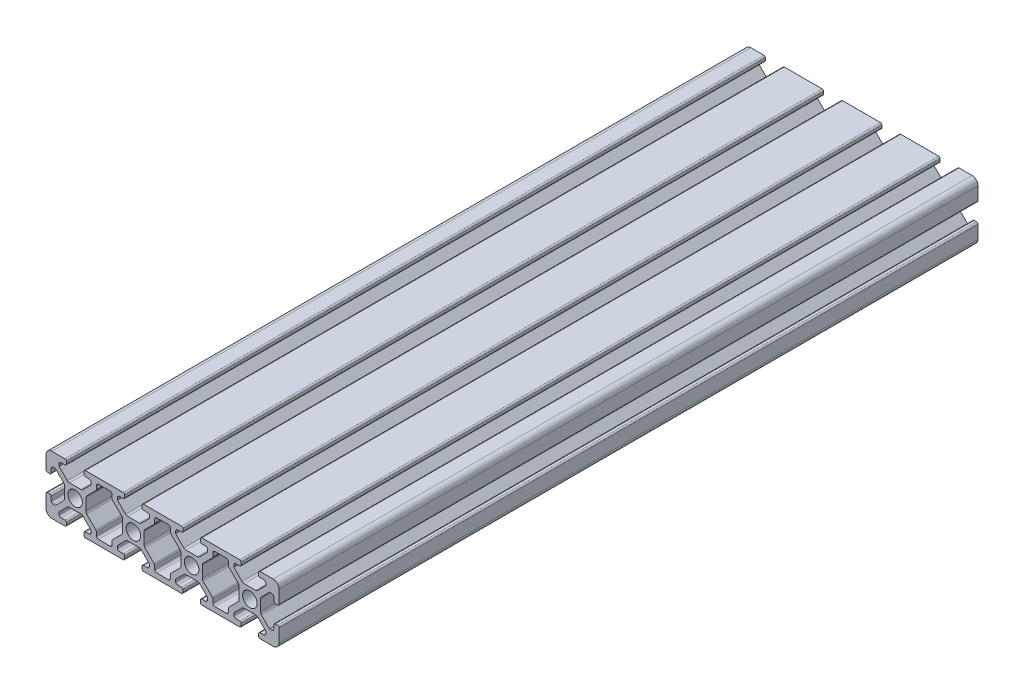
from build123d import *

# Parameters (mm, degrees)
SKETCH1_R           = 2.5
BOSS_EXTRUDE1_DEPTH = 240


with BuildPart() as part:
    # Sketch1 → Boss-Extrude1 (new body)
    with BuildSketch(Plane.XY):
        with BuildLine():
            Line((2, 0), (6.5, 0))
            ThreePointArc((6.5, 0), (6.853553391, 0.146446609), (7, 0.5))
            Line((7, 0.5), (7, 1.3))
            ThreePointArc((7, 1.3), (6.853553391, 1.653553391), (6.5, 1.8))
            Line((6.5, 1.8), (5.25, 1.8))
            ThreePointArc((5.25, 1.8), (4.719669914, 2.019669914), (4.5, 2.55))
            Line((4.5, 2.55), (4.5, 3.227207794))
            Line((4.5, 3.227207794), (7.329898987, 6.057106781))
            ThreePointArc((7.329898987, 6.057106781), (7.654322336, 6.273879533), (8.037005769, 6.35))
            Line((8.037005769, 6.35), (11.962994231, 6.35))
            ThreePointArc((11.962994231, 6.35), (12.345677664, 6.273879533), (12.670101013, 6.057106781))
            Line((12.670101013, 6.057106781), (15.5, 3.227207794))
            Line((15.5, 3.227207794), (15.5, 2.55))
            ThreePointArc((15.5, 2.55), (15.280330086, 2.019669914), (14.75, 1.8))
            Line((14.75, 1.8), (13.5, 1.8))
            ThreePointArc((13.5, 1.8), (13.146446609, 1.653553391), (13, 1.3))
            Line((13, 1.3), (13, 0.5))
            ThreePointArc((13, 0.5), (13.146446609, 0.146446609), (13.5, 0))
            Line((13.5, 0), (26.5, 0))
            ThreePointArc((26.5, 0), (26.853553391, 0.146446609), (27, 0.5))
            Line((27, 0.5), (27, 1.3))
            ThreePointArc((27, 1.3), (26.853553391, 1.653553391), (26.5, 1.8))
            Line((26.5, 1.8), (25.25, 1.8))
            ThreePointArc((25.25, 1.8), (24.719669914, 2.019669914), (24.5, 2.55))
            Line((24.5, 2.55), (24.5, 3.227207794))
            Line((24.5, 3.227207794), (27.329898987, 6.057106781))
            ThreePointArc((27.329898987, 6.057106781), (27.654322336, 6.273879533), (28.037005769, 6.35))
            Line((28.037005769, 6.35), (31.962994231, 6.35))
            ThreePointArc((31.962994231, 6.35), (32.345677664, 6.273879533), (32.670101013, 6.057106781))
            Line((32.670101013, 6.057106781), (35.5, 3.227207794))
            Line((35.5, 3.227207794), (35.5, 2.55))
            ThreePointArc((35.5, 2.55), (35.280330086, 2.019669914), (34.75, 1.8))
            Line((34.75, 1.8), (33.5, 1.8))
            ThreePointArc((33.5, 1.8), (33.146446609, 1.653553391), (33, 1.3))
            Line((33, 1.3), (33, 0.5))
            ThreePointArc((33, 0.5), (33.146446609, 0.146446609), (33.5, 0))
            Line((33.5, 0), (46.5, 0))
            ThreePointArc((46.5, 0), (46.853553391, 0.146446609), (47, 0.5))
            Line((47, 0.5), (47, 1.3))
            ThreePointArc((47, 1.3), (46.853553391, 1.653553391), (46.5, 1.8))
            Line((46.5, 1.8), (45.25, 1.8))
            ThreePointArc((45.25, 1.8), (44.719669914, 2.019669914), (44.5, 2.55))
            Line((44.5, 2.55), (44.5, 3.227207794))
            Line((44.5, 3.227207794), (47.329898987, 6.057106781))
            ThreePointArc((47.329898987, 6.057106781), (47.654322336, 6.273879533), (48.037005769, 6.35))
            Line((48.037005769, 6.35), (51.962994231, 6.35))
            ThreePointArc((51.962994231, 6.35), (52.345677664, 6.273879533), (52.670101013, 6.057106781))
            Line((52.670101013, 6.057106781), (55.5, 3.227207794))
            Line((55.5, 3.227207794), (55.5, 2.55))
            ThreePointArc((55.5, 2.55), (55.280330086, 2.019669914), (54.75, 1.8))
            Line((54.75, 1.8), (53.5, 1.8))
            ThreePointArc((53.5, 1.8), (53.146446609, 1.653553391), (53, 1.3))
            Line((53, 1.3), (53, 0.5))
            ThreePointArc((53, 0.5), (53.146446609, 0.146446609), (53.5, 0))
            Line((53.5, 0), (66.5, 0))
            ThreePointArc((66.5, 0), (66.853553391, 0.146446609), (67, 0.5))
            Line((67, 0.5), (67, 1.3))
            ThreePointArc((67, 1.3), (66.853553391, 1.653553391), (66.5, 1.8))
            Line((66.5, 1.8), (65.25, 1.8))
            ThreePointArc((65.25, 1.8), (64.719669914, 2.019669914), (64.5, 2.55))
            Line((64.5, 2.55), (64.5, 3.227207794))
            Line((64.5, 3.227207794), (67.329898987, 6.057106781))
            ThreePointArc((67.329898987, 6.057106781), (67.654322336, 6.273879533), (68.037005769, 6.35))
            Line((68.037005769, 6.35), (71.962994231, 6.35))
            ThreePointArc((71.962994231, 6.35), (72.345677664, 6.273879533), (72.670101013, 6.057106781))
            Line((72.670101013, 6.057106781), (75.5, 3.227207794))
            Line((75.5, 3.227207794), (75.5, 2.55))
            ThreePointArc((75.5, 2.55), (75.280330086, 2.019669914), (74.75, 1.8))
            Line((74.75, 1.8), (73.5, 1.8))
            ThreePointArc((73.5, 1.8), (73.146446609, 1.653553391), (73, 1.3))
            Line((73, 1.3), (73, 0.5))
            ThreePointArc((73, 0.5), (73.146446609, 0.146446609), (73.5, 0))
            Line((73.5, 0), (78, 0))
            ThreePointArc((78, 0), (79.414213562, 0.585786438), (80, 2))
            Line((80, 2), (80, 6.5))
            ThreePointArc((80, 6.5), (79.853553391, 6.853553391), (79.5, 7))
            Line((79.5, 7), (78.7, 7))
            ThreePointArc((78.7, 7), (78.346446609, 6.853553391), (78.2, 6.5))
            Line((78.2, 6.5), (78.2, 5.25))
            ThreePointArc((78.2, 5.25), (77.980330086, 4.719669914), (77.45, 4.5))
            Line((77.45, 4.5), (76.772792206, 4.5))
            Line((76.772792206, 4.5), (73.942893219, 7.329898987))
            ThreePointArc((73.942893219, 7.329898987), (73.726120467, 7.654322336), (73.65, 8.037005769))
            Line((73.65, 8.037005769), (73.65, 11.962994231))
            ThreePointArc((73.65, 11.962994231), (73.726120467, 12.345677664), (73.942893219, 12.670101013))
            Line((73.942893219, 12.670101013), (76.772792206, 15.5))
            Line((76.772792206, 15.5), (77.45, 15.5))
            ThreePointArc((77.45, 15.5), (77.980330086, 15.280330086), (78.2, 14.75))
            Line((78.2, 14.75), (78.2, 13.5))
            ThreePointArc((78.2, 13.5), (78.346446609, 13.146446609), (78.7, 13))
            Line((78.7, 13), (79.5, 13))
            ThreePointArc((79.5, 13), (79.853553391, 13.146446609), (80, 13.5))
            Line((80, 13.5), (80, 18))
            ThreePointArc((80, 18), (79.414213562, 19.414213562), (78, 20))
            Line((78, 20), (73.5, 20))
            ThreePointArc((73.5, 20), (73.146446609, 19.853553391), (73, 19.5))
            Line((73, 19.5), (73, 18.7))
            ThreePointArc((73, 18.7), (73.146446609, 18.346446609), (73.5, 18.2))
            Line((73.5, 18.2), (74.75, 18.2))
            ThreePointArc((74.75, 18.2), (75.280330086, 17.980330086), (75.5, 17.45))
            Line((75.5, 17.45), (75.5, 16.772792206))
            Line((75.5, 16.772792206), (72.670101013, 13.942893219))
            ThreePointArc((72.670101013, 13.942893219), (72.345677664, 13.726120467), (71.962994231, 13.65))
            Line((71.962994231, 13.65), (68.037005769, 13.65))
            ThreePointArc((68.037005769, 13.65), (67.654322336, 13.726120467), (67.329898987, 13.942893219))
            Line((67.329898987, 13.942893219), (64.5, 16.772792206))
            Line((64.5, 16.772792206), (64.5, 17.45))
            ThreePointArc((64.5, 17.45), (64.719669914, 17.980330086), (65.25, 18.2))
            Line((65.25, 18.2), (66.5, 18.2))
            ThreePointArc((66.5, 18.2), (66.853553391, 18.346446609), (67, 18.7))
            Line((67, 18.7), (67, 19.5))
            ThreePointArc((67, 19.5), (66.853553391, 19.853553391), (66.5, 20))
            Line((66.5, 20), (53.5, 20))
            ThreePointArc((53.5, 20), (53.146446609, 19.853553391), (53, 19.5))
            Line((53, 19.5), (53, 18.7))
            ThreePointArc((53, 18.7), (53.146446609, 18.346446609), (53.5, 18.2))
            Line((53.5, 18.2), (54.75, 18.2))
            ThreePointArc((54.75, 18.2), (55.280330086, 17.980330086), (55.5, 17.45))
            Line((55.5, 17.45), (55.5, 16.772792206))
            Line((55.5, 16.772792206), (52.670101013, 13.942893219))
            ThreePointArc((52.670101013, 13.942893219), (52.345677664, 13.726120467), (51.962994231, 13.65))
            Line((51.962994231, 13.65), (48.037005769, 13.65))
            ThreePointArc((48.037005769, 13.65), (47.654322336, 13.726120467), (47.329898987, 13.942893219))
            Line((47.329898987, 13.942893219), (44.5, 16.772792206))
            Line((44.5, 16.772792206), (44.5, 17.45))
            ThreePointArc((44.5, 17.45), (44.719669914, 17.980330086), (45.25, 18.2))
            Line((45.25, 18.2), (46.5, 18.2))
            ThreePointArc((46.5, 18.2), (46.853553391, 18.346446609), (47, 18.7))
            Line((47, 18.7), (47, 19.5))
            ThreePointArc((47, 19.5), (46.853553391, 19.853553391), (46.5, 20))
            Line((46.5, 20), (33.5, 20))
            ThreePointArc((33.5, 20), (33.146446609, 19.853553391), (33, 19.5))
            Line((33, 19.5), (33, 18.7))
            ThreePointArc((33, 18.7), (33.146446609, 18.346446609), (33.5, 18.2))
            Line((33.5, 18.2), (34.75, 18.2))
            ThreePointArc((34.75, 18.2), (35.280330086, 17.980330086), (35.5, 17.45))
            Line((35.5, 17.45), (35.5, 16.772792206))
            Line((35.5, 16.772792206), (32.670101013, 13.942893219))
            ThreePointArc((32.670101013, 13.942893219), (32.345677664, 13.726120467), (31.962994231, 13.65))
            Line((31.962994231, 13.65), (28.037005769, 13.65))
            ThreePointArc((28.037005769, 13.65), (27.654322336, 13.726120467), (27.329898987, 13.942893219))
            Line((27.329898987, 13.942893219), (24.5, 16.772792206))
            Line((24.5, 16.772792206), (24.5, 17.45))
            ThreePointArc((24.5, 17.45), (24.719669914, 17.980330086), (25.25, 18.2))
            Line((25.25, 18.2), (26.5, 18.2))
            ThreePointArc((26.5, 18.2), (26.853553391, 18.346446609), (27, 18.7))
            Line((27, 18.7), (27, 19.5))
            ThreePointArc((27, 19.5), (26.853553391, 19.853553391), (26.5, 20))
            Line((26.5, 20), (13.5, 20))
            ThreePointArc((13.5, 20), (13.146446609, 19.853553391), (13, 19.5))
            Line((13, 19.5), (13, 18.7))
            ThreePointArc((13, 18.7), (13.146446609, 18.346446609), (13.5, 18.2))
            Line((13.5, 18.2), (14.75, 18.2))
            ThreePointArc((14.75, 18.2), (15.280330086, 17.980330086), (15.5, 17.45))
            Line((15.5, 17.45), (15.5, 16.772792206))
            Line((15.5, 16.772792206), (12.670101013, 13.942893219))
            ThreePointArc((12.670101013, 13.942893219), (12.345677664, 13.726120467), (11.962994231, 13.65))
            Line((11.962994231, 13.65), (8.037005769, 13.65))
            ThreePointArc((8.037005769, 13.65), (7.654322336, 13.726120467), (7.329898987, 13.942893219))
            Line((7.329898987, 13.942893219), (4.5, 16.772792206))
            Line((4.5, 16.772792206), (4.5, 17.45))
            ThreePointArc((4.5, 17.45), (4.719669914, 17.980330086), (5.25, 18.2))
            Line((5.25, 18.2), (6.5, 18.2))
            ThreePointArc((6.5, 18.2), (6.853553391, 18.346446609), (7, 18.7))
            Line((7, 18.7), (7, 19.5))
            ThreePointArc((7, 19.5), (6.853553391, 19.853553391), (6.5, 20))
            Line((6.5, 20), (2, 20))
            ThreePointArc((2, 20), (0.585786438, 19.414213562), (0, 18))
            Line((0, 18), (0, 13.5))
            ThreePointArc((0, 13.5), (0.146446609, 13.146446609), (0.5, 13))
            Line((0.5, 13), (1.3, 13))
            ThreePointArc((1.3, 13), (1.653553391, 13.146446609), (1.8, 13.5))
            Line((1.8, 13.5), (1.8, 14.75))
            ThreePointArc((1.8, 14.75), (2.019669914, 15.280330086), (2.55, 15.5))
            Line((2.55, 15.5), (3.227207794, 15.5))
            Line((3.227207794, 15.5), (6.057106781, 12.670101013))
            ThreePointArc((6.057106781, 12.670101013), (6.273879533, 12.345677664), (6.35, 11.962994231))
            Line((6.35, 11.962994231), (6.35, 8.037005769))
            ThreePointArc((6.35, 8.037005769), (6.273879533, 7.654322336), (6.057106781, 7.329898987))
            Line((6.057106781, 7.329898987), (3.227207794, 4.5))
            Line((3.227207794, 4.5), (2.55, 4.5))
            ThreePointArc((2.55, 4.5), (2.019669914, 4.719669914), (1.8, 5.25))
            Line((1.8, 5.25), (1.8, 6.5))
            ThreePointArc((1.8, 6.5), (1.653553391, 6.853553391), (1.3, 7))
            Line((1.3, 7), (0.5, 7))
            ThreePointArc((0.5, 7), (0.146446609, 6.853553391), (0, 6.5))
            Line((0, 6.5), (0, 2))
            ThreePointArc((0, 2), (0.585786438, 0.585786438), (2, 0))
        make_face()
        with Locations((10, 10)):
            Circle(SKETCH1_R, mode=Mode.SUBTRACT)
        with Locations((30, 10)):
            Circle(SKETCH1_R, mode=Mode.SUBTRACT)
        with Locations((50, 10)):
            Circle(SKETCH1_R, mode=Mode.SUBTRACT)
        with Locations((70, 10)):
            Circle(SKETCH1_R, mode=Mode.SUBTRACT)
        with BuildLine():
            Line((33.942893219, 12.670101013), (37.080330086, 15.80753788))
            ThreePointArc((37.080330086, 15.80753788), (37.242909649, 16.050855391), (37.3, 16.337867966))
            Line((37.3, 16.337867966), (37.3, 17.45))
            ThreePointArc((37.3, 17.45), (37.519669914, 17.980330086), (38.05, 18.2))
            Line((38.05, 18.2), (41.95, 18.2))
            ThreePointArc((41.95, 18.2), (42.480330086, 17.980330086), (42.7, 17.45))
            Line((42.7, 17.45), (42.7, 16.337867966))
            ThreePointArc((42.7, 16.337867966), (42.757090351, 16.050855391), (42.919669914, 15.80753788))
            Line((42.919669914, 15.80753788), (46.057106781, 12.670101013))
            ThreePointArc((46.057106781, 12.670101013), (46.273879533, 12.345677664), (46.35, 11.962994231))
            Line((46.35, 11.962994231), (46.35, 8.037005769))
            ThreePointArc((46.35, 8.037005769), (46.273879533, 7.654322336), (46.057106781, 7.329898987))
            Line((46.057106781, 7.329898987), (42.919669914, 4.19246212))
            ThreePointArc((42.919669914, 4.19246212), (42.757090351, 3.949144609), (42.7, 3.662132034))
            Line((42.7, 3.662132034), (42.7, 2.55))
            ThreePointArc((42.7, 2.55), (42.480330086, 2.019669914), (41.95, 1.8))
            Line((41.95, 1.8), (38.05, 1.8))
            ThreePointArc((38.05, 1.8), (37.519669914, 2.019669914), (37.3, 2.55))
            Line((37.3, 2.55), (37.3, 3.662132034))
            ThreePointArc((37.3, 3.662132034), (37.242909649, 3.949144609), (37.080330086, 4.19246212))
            Line((37.080330086, 4.19246212), (33.942893219, 7.329898987))
            ThreePointArc((33.942893219, 7.329898987), (33.726120467, 7.654322336), (33.65, 8.037005769))
            Line((33.65, 8.037005769), (33.65, 11.962994231))
            ThreePointArc((33.65, 11.962994231), (33.726120467, 12.345677664), (33.942893219, 12.670101013))
        make_face(mode=Mode.SUBTRACT)
        with BuildLine():
            Line((22.919669914, 15.80753788), (26.057106781, 12.670101013))
            ThreePointArc((26.057106781, 12.670101013), (26.273879533, 12.345677664), (26.35, 11.962994231))
            Line((26.35, 11.962994231), (26.35, 8.037005769))
            ThreePointArc((26.35, 8.037005769), (26.273879533, 7.654322336), (26.057106781, 7.329898987))
            Line((26.057106781, 7.329898987), (22.919669914, 4.19246212))
            ThreePointArc((22.919669914, 4.19246212), (22.757090351, 3.949144609), (22.7, 3.662132034))
            Line((22.7, 3.662132034), (22.7, 2.55))
            ThreePointArc((22.7, 2.55), (22.480330086, 2.019669914), (21.95, 1.8))
            Line((21.95, 1.8), (18.05, 1.8))
            ThreePointArc((18.05, 1.8), (17.519669914, 2.019669914), (17.3, 2.55))
            Line((17.3, 2.55), (17.3, 3.662132034))
            ThreePointArc((17.3, 3.662132034), (17.242909649, 3.949144609), (17.080330086, 4.19246212))
            Line((17.080330086, 4.19246212), (13.942893219, 7.329898987))
            ThreePointArc((13.942893219, 7.329898987), (13.726120467, 7.654322336), (13.65, 8.037005769))
            Line((13.65, 8.037005769), (13.65, 11.962994231))
            ThreePointArc((13.65, 11.962994231), (13.726120467, 12.345677664), (13.942893219, 12.670101013))
            Line((13.942893219, 12.670101013), (17.080330086, 15.80753788))
            ThreePointArc((17.080330086, 15.80753788), (17.242909649, 16.050855391), (17.3, 16.337867966))
            Line((17.3, 16.337867966), (17.3, 17.45))
            ThreePointArc((17.3, 17.45), (17.519669914, 17.980330086), (18.05, 18.2))
            Line((18.05, 18.2), (21.95, 18.2))
            ThreePointArc((21.95, 18.2), (22.480330086, 17.980330086), (22.7, 17.45))
            Line((22.7, 17.45), (22.7, 16.337867966))
            ThreePointArc((22.7, 16.337867966), (22.757090351, 16.050855391), (22.919669914, 15.80753788))
        make_face(mode=Mode.SUBTRACT)
        with BuildLine():
            Line((62.919669914, 15.80753788), (66.057106781, 12.670101013))
            ThreePointArc((66.057106781, 12.670101013), (66.273879533, 12.345677664), (66.35, 11.962994231))
            Line((66.35, 11.962994231), (66.35, 8.037005769))
            ThreePointArc((66.35, 8.037005769), (66.273879533, 7.654322336), (66.057106781, 7.329898987))
            Line((66.057106781, 7.329898987), (62.919669914, 4.19246212))
            ThreePointArc((62.919669914, 4.19246212), (62.757090351, 3.949144609), (62.7, 3.662132034))
            Line((62.7, 3.662132034), (62.7, 2.55))
            ThreePointArc((62.7, 2.55), (62.480330086, 2.019669914), (61.95, 1.8))
            Line((61.95, 1.8), (58.05, 1.8))
            ThreePointArc((58.05, 1.8), (57.519669914, 2.019669914), (57.3, 2.55))
            Line((57.3, 2.55), (57.3, 3.662132034))
            ThreePointArc((57.3, 3.662132034), (57.242909649, 3.949144609), (57.080330086, 4.19246212))
            Line((57.080330086, 4.19246212), (53.942893219, 7.329898987))
            ThreePointArc((53.942893219, 7.329898987), (53.726120467, 7.654322336), (53.65, 8.037005769))
            Line((53.65, 8.037005769), (53.65, 11.962994231))
            ThreePointArc((53.65, 11.962994231), (53.726120467, 12.345677664), (53.942893219, 12.670101013))
            Line((53.942893219, 12.670101013), (57.080330086, 15.80753788))
            ThreePointArc((57.080330086, 15.80753788), (57.242909649, 16.050855391), (57.3, 16.337867966))
            Line((57.3, 16.337867966), (57.3, 17.45))
            ThreePointArc((57.3, 17.45), (57.519669914, 17.980330086), (58.05, 18.2))
            Line((58.05, 18.2), (61.95, 18.2))
            ThreePointArc((61.95, 18.2), (62.480330086, 17.980330086), (62.7, 17.45))
            Line((62.7, 17.45), (62.7, 16.337867966))
            ThreePointArc((62.7, 16.337867966), (62.757090351, 16.050855391), (62.919669914, 15.80753788))
        make_face(mode=Mode.SUBTRACT)
    extrude(amount=BOSS_EXTRUDE1_DEPTH)


solid = part.part
